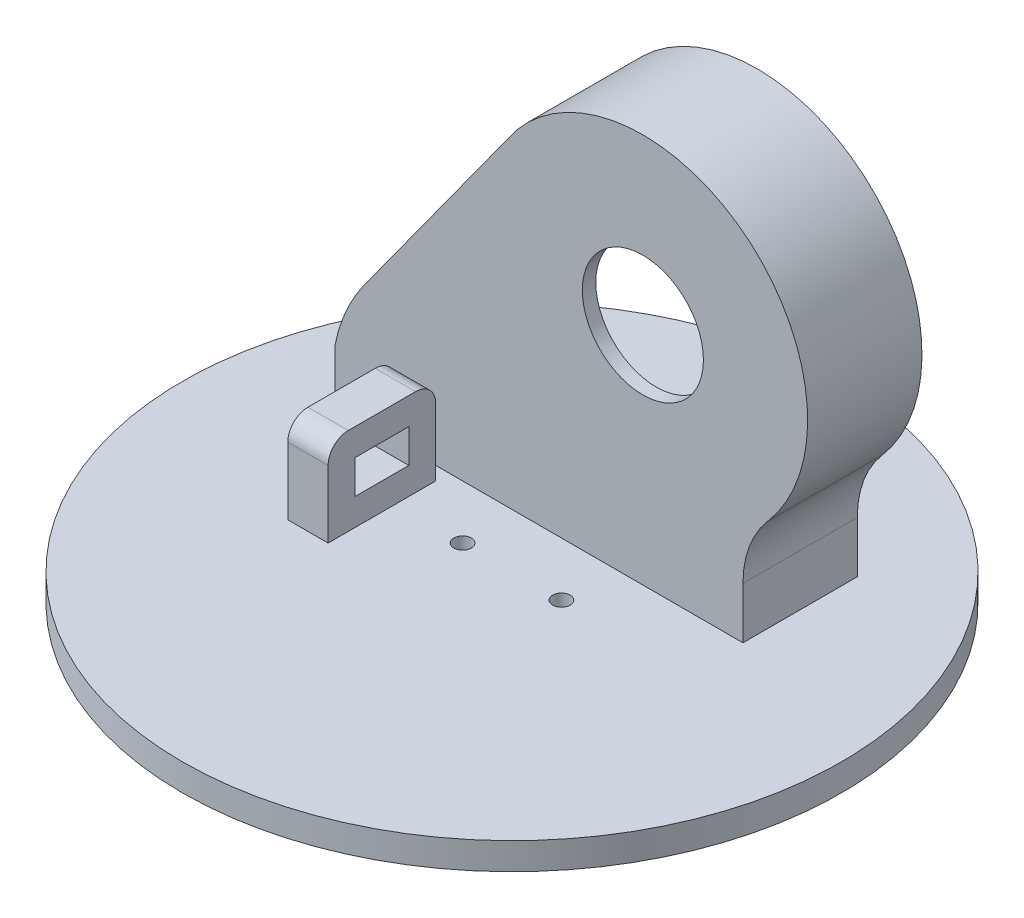
from build123d import *

# Parameters (mm, degrees)
SKETCH2_R           = 9
BOSS_EXTRUDE1_DEPTH = 17
CUT_EXTRUDE1_DEPTH  = 4
SKETCH5_R           = 9
CUT_EXTRUDE3_DEPTH  = 11
SKETCH7_R           = 2.15
CUT_EXTRUDE4_DEPTH  = 7
SKETCH8_R           = 49
SKETCH8_R_2         = 1.3
BOSS_EXTRUDE2_DEPTH = 4
SKETCH9_W           = 6
SKETCH9_H           = 16
BOSS_EXTRUDE3_DEPTH = 13
FILLET1_R           = 3
SKETCH10_W          = 8
SKETCH10_H          = 5
CUT_EXTRUDE5_DEPTH  = 13


with BuildPart() as part:
    # Sketch2 → Boss-Extrude1 (new body)
    with BuildSketch(Plane.XY):
        with BuildLine():
            Line((14.881784229, -33.477238974), (14.881784229, -25.832605203))
            ThreePointArc((14.881784229, -25.832605203), (15.824526426, -20.598724896), (18.534251304, -16.022737899))
            ThreePointArc((18.534251304, -16.022737899), (15.896271469, 18.642831184), (-18.750548152, 15.769069256))
            Line((-18.750548152, 15.769069256), (-41.495728933, -15.659285702))
            ThreePointArc((-41.495728933, -15.659285702), (-44.193480097, -20.402788352), (-45.797718556, -25.618638973))
            Line((-45.797718556, -25.618638973), (-45.797718556, -33.477238974))
            Line((-45.797718556, -33.477238974), (14.881784229, -33.477238974))
        make_face()
        Circle(SKETCH2_R, mode=Mode.SUBTRACT)
    extrude(amount=BOSS_EXTRUDE1_DEPTH)

    # Sketch4 → Cut-Extrude1 (cut)
    with BuildSketch(Plane(origin=(0, 0, 0), x_dir=(-1, 0, 0), z_dir=(0, 0, -1))):
        with BuildLine():
            Line((-11.881784229, -30.477238974), (-11.881784229, -33.477238974))
            Line((-11.881784229, -33.477238974), (42.797718556, -33.477238974))
            Line((42.797718556, -33.477238974), (42.797718556, -30.477238974))
            Line((42.797718556, -30.477238974), (42.797718556, -25.912200391))
            ThreePointArc((42.797718556, -25.912200391), (41.384433584, -21.466180319), (39.065414716, -17.418141241))
            Line((39.065414716, -17.418141241), (16.386356383, 13.918848439))
            ThreePointArc((16.386356383, 13.918848439), (-13.989938582, 16.325704757), (-16.264744719, -14.060764438))
            ThreePointArc((-16.264744719, -14.060764438), (-13.013074866, -19.551948835), (-11.881784229, -25.832605203))
            Line((-11.881784229, -25.832605203), (-11.881784229, -30.477238974))
        make_face()
    extrude(amount=-CUT_EXTRUDE1_DEPTH, mode=Mode.SUBTRACT)

    # Sketch5 → Cut-Extrude3 (cut)
    with BuildSketch(Plane(origin=(0, 0, 4), x_dir=(-1, 0, 0), z_dir=(0, 0, -1))):
        Polygon((-14.849242405, 0.707106781), (-0.707106781, 14.849242405), (27.577164466, -13.435028843), (13.435028843, -27.577164466), align=None)
        Circle(SKETCH5_R, mode=Mode.SUBTRACT)
    extrude(amount=-CUT_EXTRUDE3_DEPTH, mode=Mode.SUBTRACT)

    # Sketch7 → Cut-Extrude4 (cut)
    with BuildSketch(Plane(origin=(0, 0, 4), x_dir=(-1, 0, 0), z_dir=(0, 0, -1))):
        with Locations((-6.590235201, 15.330075016)):
            Circle(SKETCH7_R)
        with Locations((-14.580541828, 7.339768389)):
            Circle(SKETCH7_R)
        with Locations(Location((20.06769045, -27.308463889, 0), (0, 0, 180))):
            Circle(SKETCH7_R)
        with Locations(Location((28.057997077, -19.318157262, 0), (0, 0, 180))):
            Circle(SKETCH7_R)
    extrude(amount=-CUT_EXTRUDE4_DEPTH, mode=Mode.SUBTRACT)

    # Sketch8 → Boss-Extrude2 (add)
    with BuildSketch(Plane.XZ.offset(33.477238974)):
        with Locations(Location((-11.457967164, 25, 0), (0, 0, 270))):
            Circle(SKETCH8_R)
        with Locations(Location((-18.807967164, 25, 0), (0, 0, 270))):
            Circle(SKETCH8_R_2, mode=Mode.SUBTRACT)
        with Locations(Location((-4.107967164, 25, 0), (0, 0, 270))):
            Circle(SKETCH8_R_2, mode=Mode.SUBTRACT)
    extrude(amount=BOSS_EXTRUDE2_DEPTH)

    # Sketch9 → Boss-Extrude3 (add)
    with BuildSketch(Plane(origin=(0, -33.477238974, 0), x_dir=(1, 0, 0), z_dir=(0, 1, 0))):
        with Locations((-31.797718556, -27)):
            Rectangle(SKETCH9_W, SKETCH9_H)
    extrude(amount=BOSS_EXTRUDE3_DEPTH)

    # Fillet1
    fillet1_edges = [part.edges().sort_by_distance(p)[0] for p in [
        (-31.797718556, -20.477238974, 35),
        (-31.797718556, -20.477238974, 19),
    ]]
    fillet(fillet1_edges, radius=FILLET1_R)

    # Sketch10 → Cut-Extrude5 (cut)
    with BuildSketch(Plane.ZY.offset(34.797718556)):
        with Locations((27, -26.977238974)):
            Rectangle(SKETCH10_W, SKETCH10_H)
    extrude(amount=-CUT_EXTRUDE5_DEPTH, mode=Mode.SUBTRACT)


solid = part.part
